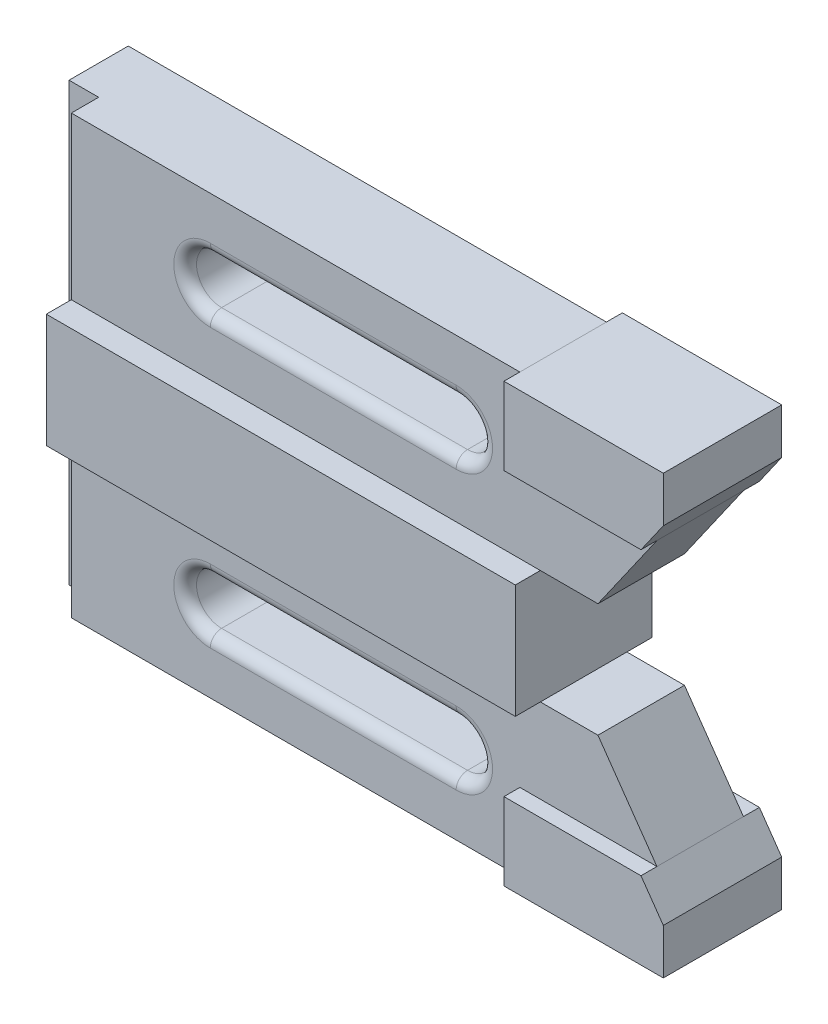
from build123d import *

# Parameters (mm, degrees)
SKETCH1_W             = 103
SKETCH1_H             = 25
BOSS_EXTRUDE1_DEPTH   = 15
BOSS_EXTRUDE2_DEPTH   = 13
BOSS_EXTRUDE2_2_DEPTH = 13
BOSS_EXTRUDE3_DEPTH   = 9.5
BOSS_EXTRUDE3_2_DEPTH = 9.5
FILLET1_R             = 2.5
FILLET2_R             = 2.5
SKETCH1_9_W           = 6.5
SKETCH1_9_H           = 96
BOSS_EXTRUDE5_DEPTH   = 9.5
SKETCH1_10_W          = 6.5
SKETCH1_10_H          = 96
BOSS_EXTRUDE6_DEPTH   = 3.5
SKETCH2_W             = 5.5
SKETCH2_H             = 25
BOSS_EXTRUDE7_DEPTH   = 6.5


with BuildPart() as part:
    # Sketch1 → Boss-Extrude1 (new, symmetric)
    with BuildSketch(Plane.XY):
        with Locations((58, 48)):
            Rectangle(SKETCH1_W, SKETCH1_H)
    extrude(amount=BOSS_EXTRUDE1_DEPTH, both=True)



with BuildPart() as body_2:
    # Sketch1<4> → Boss-Extrude2 (new, symmetric)
    with BuildSketch(Plane.XY):
        Polygon((105, 17), (105, 0), (140, 0), (140, 10), (135.098547233, 17), align=None)
    extrude(amount=BOSS_EXTRUDE2_DEPTH, both=True)


with BuildPart() as body_3:
    # Sketch1<4> → Boss-Extrude2 2 (new, symmetric)
    with BuildSketch(Plane.XY):
        Polygon((140, 96), (105, 96), (105, 79), (135.098547233, 79), (140, 86), align=None)
    extrude(amount=BOSS_EXTRUDE2_2_DEPTH, both=True)


with BuildPart() as body_4:
    # Sketch1<5> → Boss-Extrude3 (new, symmetric)
    with BuildSketch(Plane.XY):
        Polygon((105, 96), (6.5, 96), (6.5, 60.5), (109.5, 60.5), (122.144707776, 60.5), (135.098547233, 79), (105, 79), align=None)
        with BuildLine():
            ThreePointArc((37, 73), (31.5, 78.5), (37, 84))
            Line((37, 84), (91, 84))
            ThreePointArc((91, 84), (96.5, 78.5), (91, 73))
            Line((91, 73), (37, 73))
        make_face(mode=Mode.SUBTRACT)
    extrude(amount=BOSS_EXTRUDE3_DEPTH, both=True)

    # Fillet1
    fillet1_edges = [body_4.edges().sort_by_distance(p)[0] for p in [
        (64, 73, 9.5),
        (64, 84, -9.5),
        (31.5, 78.5, 9.5),
        (31.5, 78.5, -9.5),
        (64, 73, -9.5),
        (96.5, 78.5, -9.5),
        (64, 84, 9.5),
        (96.5, 78.5, 9.5),
    ]]
    fillet(fillet1_edges, radius=FILLET1_R)


with BuildPart() as body_5:
    # Sketch1<5> → Boss-Extrude3 2 (new, symmetric)
    with BuildSketch(Plane.XY):
        Polygon((109.5, 35.5), (6.5, 35.5), (6.5, 0), (105, 0), (105, 17), (135.098547233, 17), (122.144707776, 35.5), align=None)
        with BuildLine():
            ThreePointArc((37, 12), (31.5, 17.5), (37, 23))
            Line((37, 23), (91, 23))
            ThreePointArc((91, 23), (96.5, 17.5), (91, 12))
            Line((91, 12), (37, 12))
        make_face(mode=Mode.SUBTRACT)
    extrude(amount=BOSS_EXTRUDE3_2_DEPTH, both=True)

    # Fillet2
    fillet2_edges = [body_5.edges().sort_by_distance(p)[0] for p in [
        (64, 12, 9.5),
        (64, 23, -9.5),
        (31.5, 17.5, 9.5),
        (31.5, 17.5, -9.5),
        (64, 12, -9.5),
        (96.5, 17.5, -9.5),
        (64, 23, 9.5),
        (96.5, 17.5, 9.5),
    ]]
    fillet(fillet2_edges, radius=FILLET2_R)


with BuildPart() as part_1:
    add(part.part)

    add(body_4.part)  # Boss-Extrude5 merges body 4

    add(body_5.part)  # Boss-Extrude5 merges body 5
    # Sketch1<9> → Boss-Extrude5 (add)
    with BuildSketch(Plane.XY):
        with Locations((3.25, 48)):
            Rectangle(SKETCH1_9_W, SKETCH1_9_H)
    extrude(amount=-BOSS_EXTRUDE5_DEPTH)

    # Sketch1<10> → Boss-Extrude6 (add)
    with BuildSketch(Plane.XY):
        with Locations((3.25, 48)):
            Rectangle(SKETCH1_10_W, SKETCH1_10_H)
    extrude(amount=BOSS_EXTRUDE6_DEPTH)

    # Sketch2 → Boss-Extrude7 (add)
    with BuildSketch(Plane.ZY.offset(-6.5)):
        with Locations((-12.25, 48)):
            Rectangle(SKETCH2_W, SKETCH2_H)
    extrude(amount=BOSS_EXTRUDE7_DEPTH)


solid = Compound([body_2.part, body_3.part, part_1.part])
